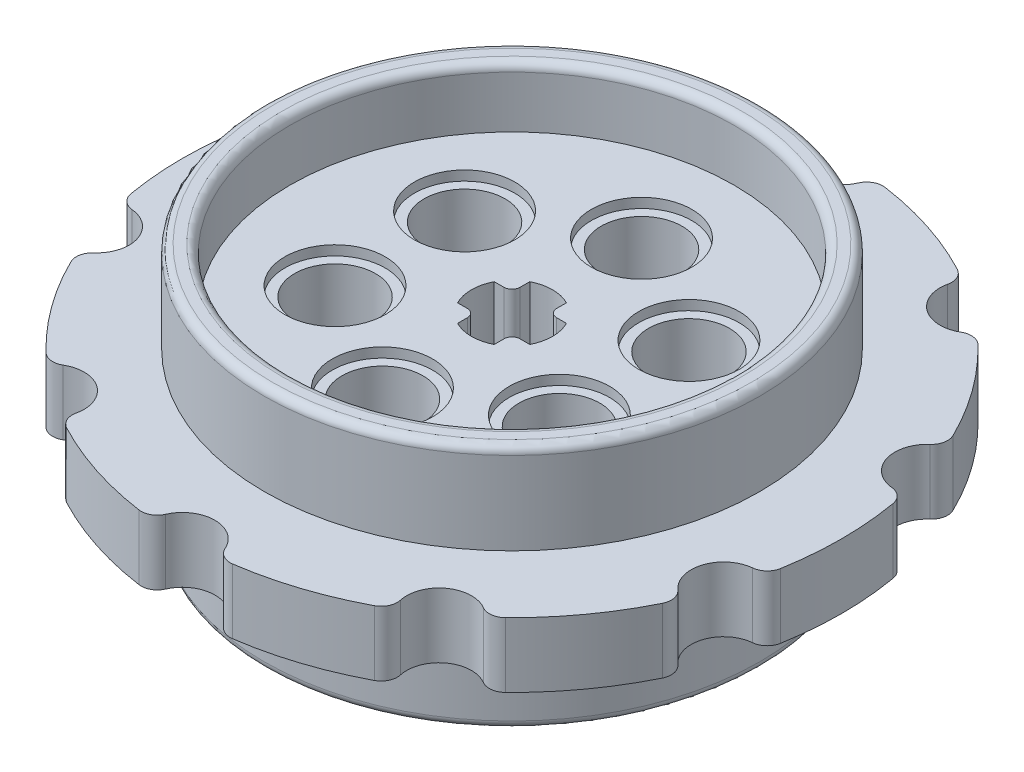
from build123d import *

# Parameters (mm, degrees)
SKETCH_1_R                       = 15.3
SKETCH_1_R_2                     = 13.7
EXTRUDE_1_DEPTH                  = 7.6
SKETCH_1_3_R                     = 20.35
EXTRUDE_2_DEPTH                  = 2
SKETCH_1_4_R                     = 2
CUT_EXTRUDE_1_DEPTH              = 30.765836121
FILLET_1_R                       = 1
PATTERN_CIRCULAR_1_COUNT         = 10
FILLET_1_OF_PATTERN_CIRCULAR_1_R = 1
FILLET_2_R                       = 0.5
SKETCH_1_5_R                     = 13.7
EXTRUDE_3_DEPTH                  = 3.9
SKETCH_3_R                       = 3.1
CUT_EXTRUDE_2_DEPTH              = 30.631801228
SKETCH_3_3_R                     = 3.1
SKETCH_3_3_R_2                   = 2.5
EXTRUDE_4_DEPTH                  = 3.3
PATTERN_CIRCULAR_2_COUNT         = 6
CUT_EXTRUDE_3_DEPTH              = 30.631801228
CUT_EXTRUDE_3_DEPTH_BACK         = 30.631801228
FILLET_3_R                       = 0.5


with BuildPart() as part:
    # 草图1 → 凸台-拉伸1 (new, symmetric)
    with BuildSketch(Plane(origin=(0, 0, 0), x_dir=(1, 0, 0), z_dir=(0, 1, 0))):
        Circle(SKETCH_1_R)
        Circle(SKETCH_1_R_2, mode=Mode.SUBTRACT)
    extrude(amount=EXTRUDE_1_DEPTH, both=True)

    # 草图1<3> → 凸台-拉伸2 (add, symmetric)
    with BuildSketch(Plane(origin=(0, 0, 0), x_dir=(1, 0, 0), z_dir=(0, 1, 0))):
        Circle(SKETCH_1_3_R)
    extrude(amount=EXTRUDE_2_DEPTH, both=True)

    # 草图1<4> → 切除-拉伸1 (cut, symmetric)
    with BuildSketch(Plane(origin=(0, 0, 0), x_dir=(1, 0, 0), z_dir=(0, 1, 0))):
        with Locations((0, 20.35)):
            Circle(SKETCH_1_4_R)
    cut_extrude_1 = extrude(amount=CUT_EXTRUDE_1_DEPTH, both=True, mode=Mode.SUBTRACT)

    # 圆角1
    fillet_1_edges = [part.edges().sort_by_distance(p)[0] for p in [
        (1.997583796, 0, -20.251719902),
        (-1.997583796, 0, -20.251719902),
    ]]
    fillet(fillet_1_edges, radius=FILLET_1_R)

    # 阵列(圆周)1: 切除-拉伸1 ×10 about axis
    pattern_circular_1_axis = Axis((0, 2, 0), (0, -1, 0))
    for i in range(1, PATTERN_CIRCULAR_1_COUNT):
        add(cut_extrude_1.rotate(pattern_circular_1_axis, i * 360 / PATTERN_CIRCULAR_1_COUNT), mode=Mode.SUBTRACT)

    # 圆角1 of 阵列(圆周)1
    fillet_1_of_pattern_circular_1_edges = [part.edges().sort_by_distance(p)[0] for p in [
        (13.51974153, 0, -15.20983527),
        (10.287583053, 0, -17.558135861),
        (19.877817519, 0, -4.358310529),
        (18.643242838, 0, -8.157940701),
        (18.643242838, 0, 8.157940701),
        (19.877817519, 0, 4.358310529),
        (10.287583053, 0, 17.558135861),
        (13.51974153, 0, 15.20983527),
        (-1.997583796, 0, 20.251719902),
        (1.997583796, 0, 20.251719902),
        (-13.51974153, 0, 15.20983527),
        (-10.287583053, 0, 17.558135861),
        (-19.877817519, 0, 4.358310529),
        (-18.643242838, 0, 8.157940701),
        (-18.643242838, 0, -8.157940701),
        (-19.877817519, 0, -4.358310529),
        (-10.287583053, 0, -17.558135861),
        (-13.51974153, 0, -15.20983527),
    ]]
    fillet(fillet_1_of_pattern_circular_1_edges, radius=FILLET_1_OF_PATTERN_CIRCULAR_1_R)

    # 圆角2
    fillet_2_edges = [part.edges().sort_by_distance(p)[0] for p in [
        (-13.7, -7.6, 0),
        (-15.3, -7.6, 0),
        (-13.7, 7.6, 0),
        (-15.3, 7.6, 0),
    ]]
    fillet(fillet_2_edges, radius=FILLET_2_R)

    # 草图1<5> → 凸台-拉伸3 (add, symmetric)
    with BuildSketch(Plane(origin=(0, 0, 0), x_dir=(1, 0, 0), z_dir=(0, 1, 0))):
        Circle(SKETCH_1_5_R)
    extrude(amount=EXTRUDE_3_DEPTH, both=True)

    # 草图3 → 切除-拉伸2 (cut, symmetric)
    with BuildSketch(Plane(origin=(0, 0, 0), x_dir=(1, 0, 0), z_dir=(0, 1, 0))):
        with Locations((0, 8)):
            Circle(SKETCH_3_R)
    cut_extrude_2 = extrude(amount=CUT_EXTRUDE_2_DEPTH, both=True, mode=Mode.SUBTRACT)

    # 草图3<3> → 凸台-拉伸4 (add, symmetric)
    with BuildSketch(Plane(origin=(0, 0, 0), x_dir=(1, 0, 0), z_dir=(0, 1, 0))):
        with Locations((0, 8)):
            Circle(SKETCH_3_3_R)
        with Locations((0, 8)):
            Circle(SKETCH_3_3_R_2, mode=Mode.SUBTRACT)
    extrude_4 = extrude(amount=EXTRUDE_4_DEPTH, both=True)

    # 阵列(圆周)2: 切除-拉伸2, 凸台-拉伸4 ×6 about axis
    pattern_circular_2_axis = Axis((0, 7.6, 0), (0, -1, 0))
    add([cut_extrude_2.rotate(pattern_circular_2_axis, i * 360 / PATTERN_CIRCULAR_2_COUNT) for i in range(1, PATTERN_CIRCULAR_2_COUNT)], mode=Mode.SUBTRACT)
    add([extrude_4.rotate(pattern_circular_2_axis, i * 360 / PATTERN_CIRCULAR_2_COUNT) for i in range(1, PATTERN_CIRCULAR_2_COUNT)])

    # 草图3<4> → 切除-拉伸3 (cut, two sides: drawn at the far end of the back side and taken through both)
    with BuildSketch(Plane(origin=(0, 0, 0), x_dir=(1, 0, 0), z_dir=(0, 1, 0)).offset(-CUT_EXTRUDE_3_DEPTH_BACK)):
        with BuildLine():
            Line((-1.130029762, -1.130029762), (-1.130029762, -2.230029762))
            ThreePointArc((-1.130029762, -2.230029762), (0, -2.5), (1.130029762, -2.230029762))
            Line((1.130029762, -2.230029762), (1.130029762, -1.130029762))
            Line((1.130029762, -1.130029762), (2.230029762, -1.130029762))
            ThreePointArc((2.230029762, -1.130029762), (2.5, 0), (2.230029762, 1.130029762))
            Line((2.230029762, 1.130029762), (1.130029762, 1.130029762))
            Line((1.130029762, 1.130029762), (1.130029762, 2.230029762))
            ThreePointArc((1.130029762, 2.230029762), (0, 2.5), (-1.130029762, 2.230029762))
            Line((-1.130029762, 2.230029762), (-1.130029762, 1.130029762))
            Line((-1.130029762, 1.130029762), (-2.230029762, 1.130029762))
            ThreePointArc((-2.230029762, 1.130029762), (-2.5, 0), (-2.230029762, -1.130029762))
            Line((-2.230029762, -1.130029762), (-1.130029762, -1.130029762))
        make_face()
    extrude(amount=CUT_EXTRUDE_3_DEPTH + CUT_EXTRUDE_3_DEPTH_BACK, mode=Mode.SUBTRACT)

    # 圆角3
    fillet_3_edges = [part.edges().sort_by_distance(p)[0] for p in [
        (1.130029762, 0, 1.130029762),
        (1.130029762, 0, -1.130029762),
        (-1.130029762, 0, -1.130029762),
        (-1.130029762, 0, 1.130029762),
    ]]
    fillet(fillet_3_edges, radius=FILLET_3_R)


solid = part.part
